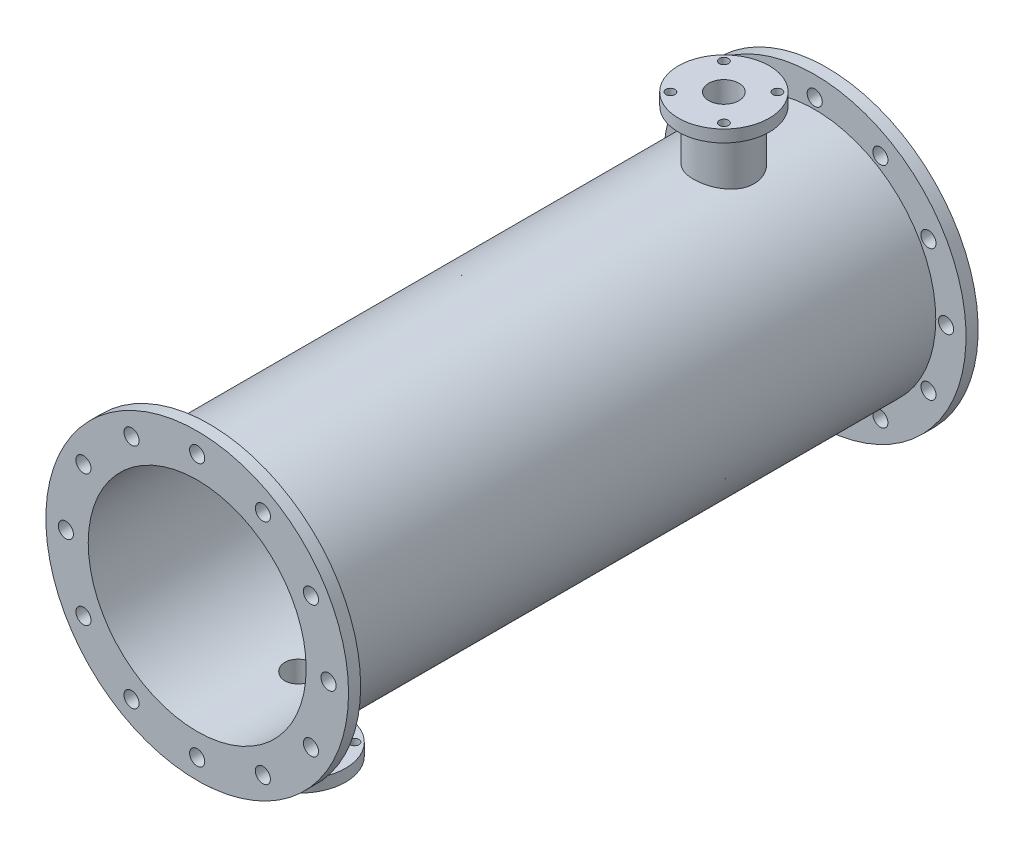
from build123d import *
from build123d.topology import SkipClean

# Parameters (mm, degrees)
SKETCH1_R           = 200
SKETCH1_R_2         = 180
BOSS_EXTRUDE1_DEPTH = 1000
SKETCH7_R           = 25
CUT_EXTRUDE1_DEPTH  = 150
CUT_EXTRUDE2_START  = -150
SKETCH9_R           = 25
CUT_EXTRUDE2_DEPTH  = 150
SKETCH10_R          = 7.5
CUT_EXTRUDE3_DEPTH  = 50
SKETCH11_R          = 7.5
CUT_EXTRUDE4_DEPTH  = 50
SKETCH12_R          = 250
SKETCH12_R_2        = 180
SKETCH12_R_3        = 12.5
BOSS_EXTRUDE3_DEPTH = 20
BOSS_EXTRUDE4_START = 20
SKETCH13_R          = 250
SKETCH13_R_2        = 180
SKETCH13_R_3        = 12.5
BOSS_EXTRUDE4_DEPTH = 20


with BuildPart() as part:
    # Sketch1 → Boss-Extrude1 (new body)
    with BuildSketch(Plane.XY):
        Circle(SKETCH1_R)
        Circle(SKETCH1_R_2, mode=Mode.SUBTRACT)
    extrude(amount=BOSS_EXTRUDE1_DEPTH)

    # Sketch6 → Revolve1 (revolve)
    with BuildSketch(Plane.XY.offset(150), mode=Mode.PRIVATE) as revolve1_sk:
        Polygon((-50, 280), (-50, 200), (-50, 193.64916731), (-25, 197.95191434), (-25, 200), (-25, 300), (-75, 300), (-75, 280), align=None)
    revolve(revolve1_sk.sketch.rotate(Axis((0, 0, 150), (0, 1, 0)), 270), axis=Axis((0, 0, 150), (0, 1, 0)))

    # Sketch7 → Cut-Extrude1 (cut)
    with BuildSketch(Plane(origin=(0, 300, 0), x_dir=(1, 0, 0), z_dir=(0, 1, 0))):
        with Locations(Location((0, -150, 0), (0, 0, 90))):
            Circle(SKETCH7_R)
    extrude(amount=-CUT_EXTRUDE1_DEPTH, mode=Mode.SUBTRACT)

    # Sketch8 → Revolve2 (revolve)
    with BuildSketch(Plane.XY.offset(850), mode=Mode.PRIVATE) as revolve2_sk:
        Polygon((25, -200), (25, -198.43134833), (50, -192.573097089), (50, -200), (50, -280), (75, -280), (75, -300), (25, -300), align=None)
    revolve(revolve2_sk.sketch.rotate(Axis((0, 0, 850), (0, -1, 0)), 90), axis=Axis((0, 0, 850), (0, -1, 0)))

    # Sketch9 → Cut-Extrude2 (cut)
    with BuildSketch(Plane.XZ.offset(300).offset(CUT_EXTRUDE2_START)):
        with Locations(Location((0, 850, 0), (0, 0, 90))):
            Circle(SKETCH9_R)
    extrude(amount=CUT_EXTRUDE2_DEPTH, mode=Mode.SUBTRACT)

    # Sketch10 → Cut-Extrude3 (cut)
    with BuildSketch(Plane(origin=(0, 300, 0), x_dir=(1, 0, 0), z_dir=(0, 1, 0))):
        with Locations(Location((44.205459665, -105.794540335, 0), (0, 0, 270))):
            Circle(SKETCH10_R)
        with Locations(Location((44.205459665, -194.205459665, 0), (0, 0, 270))):
            Circle(SKETCH10_R)
        with Locations(Location((-44.205459665, -194.205459665, 0), (0, 0, 270))):
            Circle(SKETCH10_R)
        with Locations(Location((-44.205459665, -105.794540335, 0), (0, 0, 270))):
            Circle(SKETCH10_R)
    extrude(amount=-CUT_EXTRUDE3_DEPTH, mode=Mode.SUBTRACT)

    # Sketch11 → Cut-Extrude4 (cut)
    with BuildSketch(Plane.XZ.offset(300)):
        with Locations(Location((44.90341113, 894.90341113, 0), (0, 0, 270))):
            Circle(SKETCH11_R)
        with Locations(Location((44.90341113, 805.09658887, 0), (0, 0, 270))):
            Circle(SKETCH11_R)
        with Locations(Location((-44.90341113, 805.09658887, 0), (0, 0, 270))):
            Circle(SKETCH11_R)
        with Locations(Location((-44.90341113, 894.90341113, 0), (0, 0, 270))):
            Circle(SKETCH11_R)
    extrude(amount=-CUT_EXTRUDE4_DEPTH, mode=Mode.SUBTRACT)

    # Sketch12 → Boss-Extrude3 (add)
    with BuildSketch(Plane.XY.offset(1000)):
        Circle(SKETCH12_R)
        Circle(SKETCH12_R_2, mode=Mode.SUBTRACT)
        with Locations((0, 216.956644397)):
            Circle(SKETCH12_R_3, mode=Mode.SUBTRACT)
        with Locations((108.478322199, 187.889965568)):
            Circle(SKETCH12_R_3, mode=Mode.SUBTRACT)
        with Locations((187.889965568, 108.478322199)):
            Circle(SKETCH12_R_3, mode=Mode.SUBTRACT)
        with Locations((216.956644397, 0)):
            Circle(SKETCH12_R_3, mode=Mode.SUBTRACT)
        with Locations((187.889965568, -108.478322199)):
            Circle(SKETCH12_R_3, mode=Mode.SUBTRACT)
        with Locations((108.478322199, -187.889965568)):
            Circle(SKETCH12_R_3, mode=Mode.SUBTRACT)
        with Locations((0, -216.956644397)):
            Circle(SKETCH12_R_3, mode=Mode.SUBTRACT)
        with Locations((-108.478322199, -187.889965568)):
            Circle(SKETCH12_R_3, mode=Mode.SUBTRACT)
        with Locations((-187.889965568, -108.478322199)):
            Circle(SKETCH12_R_3, mode=Mode.SUBTRACT)
        with Locations((-216.956644397, 0)):
            Circle(SKETCH12_R_3, mode=Mode.SUBTRACT)
        with Locations((-187.889965568, 108.478322199)):
            Circle(SKETCH12_R_3, mode=Mode.SUBTRACT)
        with Locations((-108.478322199, 187.889965568)):
            Circle(SKETCH12_R_3, mode=Mode.SUBTRACT)
    extrude(amount=BOSS_EXTRUDE3_DEPTH)

    # Sketch13 → Boss-Extrude4 (add)
    with SkipClean():  # the faces are left unmerged after this step: merging them gives an invalid solid
        with BuildSketch(Plane(origin=(0, 0, 0), x_dir=(-1, 0, 0), z_dir=(0, 0, -1)).offset(BOSS_EXTRUDE4_START)):
            with Locations(Location((0, 0, 0), (0, 0, 180))):
                Circle(SKETCH13_R)
            Circle(SKETCH13_R_2, mode=Mode.SUBTRACT)
            with Locations(Location((216.956644397, 0, 0), (0, 0, 180))):
                Circle(SKETCH13_R_3, mode=Mode.SUBTRACT)
            with Locations(Location((187.889965568, -108.478322199, 0), (0, 0, 180))):
                Circle(SKETCH13_R_3, mode=Mode.SUBTRACT)
            with Locations(Location((108.478322199, -187.889965568, 0), (0, 0, 180))):
                Circle(SKETCH13_R_3, mode=Mode.SUBTRACT)
            with Locations(Location((0, -216.956644397, 0), (0, 0, 180))):
                Circle(SKETCH13_R_3, mode=Mode.SUBTRACT)
            with Locations(Location((-108.478322199, -187.889965568, 0), (0, 0, 180))):
                Circle(SKETCH13_R_3, mode=Mode.SUBTRACT)
            with Locations(Location((-187.889965568, -108.478322199, 0), (0, 0, 180))):
                Circle(SKETCH13_R_3, mode=Mode.SUBTRACT)
            with Locations(Location((-216.956644397, 0, 0), (0, 0, 180))):
                Circle(SKETCH13_R_3, mode=Mode.SUBTRACT)
            with Locations(Location((-187.889965568, 108.478322199, 0), (0, 0, 180))):
                Circle(SKETCH13_R_3, mode=Mode.SUBTRACT)
            with Locations(Location((-108.478322199, 187.889965568, 0), (0, 0, 180))):
                Circle(SKETCH13_R_3, mode=Mode.SUBTRACT)
            with Locations(Location((0, 216.956644397, 0), (0, 0, 180))):
                Circle(SKETCH13_R_3, mode=Mode.SUBTRACT)
            with Locations(Location((108.478322199, 187.889965568, 0), (0, 0, 180))):
                Circle(SKETCH13_R_3, mode=Mode.SUBTRACT)
            with Locations(Location((187.889965568, 108.478322199, 0), (0, 0, 180))):
                Circle(SKETCH13_R_3, mode=Mode.SUBTRACT)
        extrude(amount=-BOSS_EXTRUDE4_DEPTH)


solid = part.part
